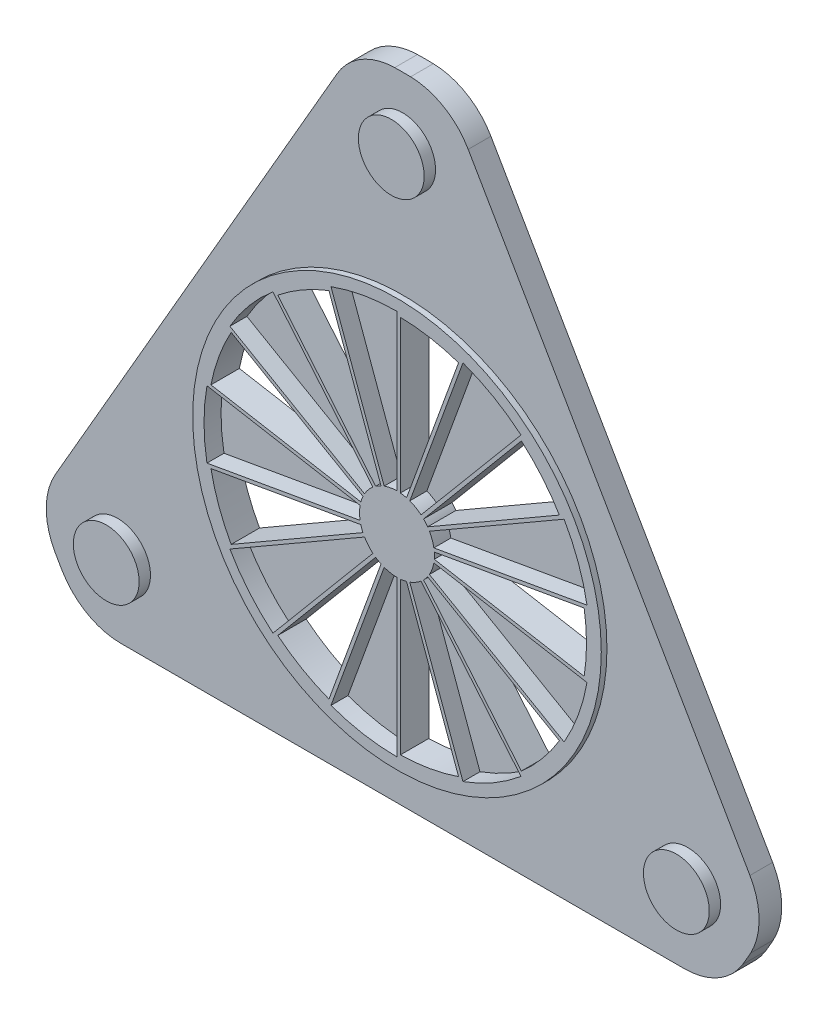
from build123d import *
from build123d.topology import SkipClean

# Parameters (mm, degrees)
SKETCH2_R           = 18
BOSS_EXTRUDE1_DEPTH = 2.5
BOSS_EXTRUDE7_START = -1
BOSS_EXTRUDE7_DEPTH = 1
BOSS_EXTRUDE9_START = -2.5
SKETCH17_R          = 3.3
BOSS_EXTRUDE9_DEPTH = 2.5
SKETCH9_R           = 3.098061326
BOSS_EXTRUDE5_DEPTH = 2.5
BOSS_EXTRUDE2_START = -2
SKETCH3_R           = 35
SKETCH3_R_2         = 18
BOSS_EXTRUDE2_DEPTH = 2
SKETCH4_R           = 2.9
BOSS_EXTRUDE3_DEPTH = 3
SKETCH6_R           = 5
BOSS_EXTRUDE4_DEPTH = 1
SKETCH7_R           = 59.131365533
CUT_EXTRUDE1_DEPTH  = 10
FILLET1_R           = 6


with BuildPart() as part:
    # Sketch2 → Boss-Extrude1 (new body)
    # profile 1 of 37: a face of its own
    with BuildSketch(Plane.XY.offset(10)):
        Circle(SKETCH2_R)
        with BuildLine():
            ThreePointArc((-5.814342437, 15.974774553), (-2.95201902, 16.741731801), (0, 17))
            ThreePointArc((0, 17), (2.95201902, 16.741731801), (5.814342437, 15.974774553))
            ThreePointArc((5.814342437, 15.974774553), (8.5, 14.722431864), (10.927389365, 13.022755533))
            ThreePointArc((10.927389365, 13.022755533), (13.022755533, 10.927389365), (14.722431864, 8.5))
            ThreePointArc((14.722431864, 8.5), (15.974774553, 5.814342437), (16.741731801, 2.95201902))
            ThreePointArc((16.741731801, 2.95201902), (16.935309868, 1.481647627), (17, 0))
            ThreePointArc((17, 0), (16.935309868, -1.481647627), (16.741731801, -2.95201902))
            ThreePointArc((16.741731801, -2.95201902), (15.974774553, -5.814342437), (14.722431864, -8.5))
            ThreePointArc((14.722431864, -8.5), (13.022755533, -10.927389365), (10.927389365, -13.022755533))
            ThreePointArc((10.927389365, -13.022755533), (8.5, -14.722431864), (5.814342437, -15.974774553))
            ThreePointArc((5.814342437, -15.974774553), (2.95201902, -16.741731801), (0, -17))
            ThreePointArc((0, -17), (-2.95201902, -16.741731801), (-5.814342437, -15.974774553))
            ThreePointArc((-5.814342437, -15.974774553), (-8.5, -14.722431864), (-10.927389365, -13.022755533))
            ThreePointArc((-10.927389365, -13.022755533), (-13.022755533, -10.927389365), (-14.722431864, -8.5))
            ThreePointArc((-14.722431864, -8.5), (-15.974774553, -5.814342437), (-16.741731801, -2.95201902))
            ThreePointArc((-16.741731801, -2.95201902), (-17, 0), (-16.741731801, 2.95201902))
            ThreePointArc((-16.741731801, 2.95201902), (-15.974774553, 5.814342437), (-14.722431864, 8.5))
            ThreePointArc((-14.722431864, 8.5), (-13.022755533, 10.927389365), (-10.927389365, 13.022755533))
            ThreePointArc((-10.927389365, 13.022755533), (-8.5, 14.722431864), (-5.814342437, 15.974774553))
        make_face(mode=Mode.SUBTRACT)
    # profile 2 of 37: a face of its own
    with BuildSketch(Plane.XY.offset(10)):
        with BuildLine():
            Line((0, 17), (0, 16.697537549))
            ThreePointArc((0, 16.697537549), (0.150006053, 16.696863729), (0.3, 16.694842323))
            ThreePointArc((0.3, 16.694842323), (2.899496967, 16.443864434), (5.428064578, 15.790626179))
            ThreePointArc((5.428064578, 15.790626179), (5.569704144, 15.741224728), (5.710894186, 15.69055282))
            Line((5.710894186, 15.69055282), (5.814342437, 15.974774553))
            ThreePointArc((5.814342437, 15.974774553), (2.95201902, 16.741731801), (0, 17))
        make_face()
    # profile 3 of 37: a face of its own
    with BuildSketch(Plane.XY.offset(10)):
        with BuildLine():
            ThreePointArc((-5.99188015, 15.585414093), (-5.851623307, 15.638614544), (-5.710894186, 15.69055282))
            Line((-5.710894186, 15.69055282), (-5.814342437, 15.974774553))
            ThreePointArc((-5.814342437, 15.974774553), (-8.5, 14.722431864), (-10.927389365, 13.022755533))
            Line((-10.927389365, 13.022755533), (-10.732970249, 12.791055853))
            ThreePointArc((-10.732970249, 12.791055853), (-10.617625822, 12.886961709), (-10.501424458, 12.981827473))
            ThreePointArc((-10.501424458, 12.981827473), (-8.348768774, 14.460491698), (-5.99188015, 15.585414093))
        make_face()
    # profile 4 of 37: a face of its own
    with BuildSketch(Plane.XY.offset(10)):
        with BuildLine():
            ThreePointArc((-14.608157564, 8.08761354), (-14.534911179, 8.218522811), (-14.460491698, 8.348768774))
            Line((-14.460491698, 8.348768774), (-14.722431864, 8.5))
            ThreePointArc((-14.722431864, 8.5), (-15.974774553, 5.814342437), (-16.741731801, 2.95201902))
            Line((-16.741731801, 2.95201902), (-16.443864434, 2.899496967))
            ThreePointArc((-16.443864434, 2.899496967), (-16.417152573, 3.047107084), (-16.389115702, 3.194471272))
            ThreePointArc((-16.389115702, 3.194471272), (-15.69055282, 5.710894186), (-14.608157564, 8.08761354))
        make_face()
    # profile 5 of 37: a face of its own
    with BuildSketch(Plane.XY.offset(10)):
        with BuildLine():
            ThreePointArc((-16.389115702, -3.194471272), (-16.417152573, -3.047107084), (-16.443864434, -2.899496967))
            Line((-16.443864434, -2.899496967), (-16.741731801, -2.95201902))
            ThreePointArc((-16.741731801, -2.95201902), (-15.974774553, -5.814342437), (-14.722431864, -8.5))
            Line((-14.722431864, -8.5), (-14.460491698, -8.348768774))
            ThreePointArc((-14.460491698, -8.348768774), (-14.534911179, -8.218522811), (-14.608157564, -8.08761354))
            ThreePointArc((-14.608157564, -8.08761354), (-15.69055282, -5.710894186), (-16.389115702, -3.194471272))
        make_face()
    # profile 6 of 37: a face of its own
    with BuildSketch(Plane.XY.offset(10)):
        with BuildLine():
            ThreePointArc((-10.501424458, -12.981827473), (-10.617625822, -12.886961709), (-10.732970249, -12.791055853))
            Line((-10.732970249, -12.791055853), (-10.927389365, -13.022755533))
            ThreePointArc((-10.927389365, -13.022755533), (-8.5, -14.722431864), (-5.814342437, -15.974774553))
            Line((-5.814342437, -15.974774553), (-5.710894186, -15.69055282))
            ThreePointArc((-5.710894186, -15.69055282), (-5.851623307, -15.638614544), (-5.99188015, -15.585414093))
            ThreePointArc((-5.99188015, -15.585414093), (-8.348768774, -14.460491698), (-10.501424458, -12.981827473))
        make_face()
    # profile 7 of 37: a face of its own
    with BuildSketch(Plane.XY.offset(10)):
        with BuildLine():
            Line((5.814342437, -15.974774553), (5.710894186, -15.69055282))
            ThreePointArc((5.710894186, -15.69055282), (5.569704144, -15.741224728), (5.428064578, -15.790626179))
            ThreePointArc((5.428064578, -15.790626179), (2.899496967, -16.443864434), (0.3, -16.694842323))
            ThreePointArc((0.3, -16.694842323), (0.150006053, -16.696863729), (0, -16.697537549))
            Line((0, -16.697537549), (0, -17))
            ThreePointArc((0, -17), (2.95201902, -16.741731801), (5.814342437, -15.974774553))
        make_face()
    # profile 8 of 37: a face of its own
    with BuildSketch(Plane.XY.offset(10)):
        with BuildLine():
            Line((14.722431864, -8.5), (14.460491698, -8.348768774))
            ThreePointArc((14.460491698, -8.348768774), (14.384905126, -8.478340917), (14.308157564, -8.607228783))
            ThreePointArc((14.308157564, -8.607228783), (12.791055853, -10.732970249), (10.961051124, -12.596154907))
            ThreePointArc((10.961051124, -12.596154907), (10.847448429, -12.694117644), (10.732970249, -12.791055853))
            Line((10.732970249, -12.791055853), (10.927389365, -13.022755533))
            ThreePointArc((10.927389365, -13.022755533), (13.022755533, -10.927389365), (14.722431864, -8.5))
        make_face()
    # profile 9 of 37: a face of its own
    with BuildSketch(Plane.XY.offset(10)):
        with BuildLine():
            ThreePointArc((0.842085099, 3.190751116), (0.986397435, 3.149130054), (1.128666473, 3.100985649))
            Line((1.128666473, 3.100985649), (5.710894186, 15.69055282))
            ThreePointArc((5.710894186, 15.69055282), (5.569704144, 15.741224728), (5.428064578, 15.790626179))
            Line((5.428064578, 15.790626179), (0.842085099, 3.190751116))
        make_face()
    # profile 10 of 37: a face of its own
    with BuildSketch(Plane.XY.offset(10)):
        with BuildLine():
            Line((0, 16.697537549), (0, 3.3))
            ThreePointArc((0, 3.3), (0.150155522, 3.296582066), (0.3, 3.286335345))
            Line((0.3, 3.286335345), (0.3, 16.694842323))
            ThreePointArc((0.3, 16.694842323), (0.150006053, 16.696863729), (0, 16.697537549))
        make_face()
    # profile 11 of 37: a face of its own
    with BuildSketch(Plane.XY.offset(10)):
        with BuildLine():
            ThreePointArc((-1.405900672, 2.98553903), (-1.268597506, 3.046417628), (-1.128666473, 3.100985649))
            Line((-1.128666473, 3.100985649), (-5.710894186, 15.69055282))
            ThreePointArc((-5.710894186, 15.69055282), (-5.851623307, 15.638614544), (-5.99188015, 15.585414093))
            Line((-5.99188015, 15.585414093), (-1.405900672, 2.98553903))
        make_face()
    # profile 12 of 37: a face of its own
    with BuildSketch(Plane.XY.offset(10)):
        with BuildLine():
            Line((-10.732970249, 12.791055853), (-2.121199112, 2.527946662))
            ThreePointArc((-2.121199112, 2.527946662), (-2.003976303, 2.621846482), (-1.882602308, 2.710315212))
            Line((-1.882602308, 2.710315212), (-10.501424458, 12.981827473))
            ThreePointArc((-10.501424458, 12.981827473), (-10.617625822, 12.886961709), (-10.732970249, 12.791055853))
        make_face()
    # profile 13 of 37: a face of its own
    with BuildSketch(Plane.XY.offset(10)):
        with BuildLine():
            ThreePointArc((-2.996049894, 1.383360051), (-2.930001576, 1.518252537), (-2.857883832, 1.65))
            Line((-2.857883832, 1.65), (-14.460491698, 8.348768774))
            ThreePointArc((-14.460491698, 8.348768774), (-14.534911179, 8.218522811), (-14.608157564, 8.08761354))
            Line((-14.608157564, 8.08761354), (-2.996049894, 1.383360051))
        make_face()
    # profile 14 of 37: a face of its own
    with BuildSketch(Plane.XY.offset(10)):
        with BuildLine():
            Line((-16.443864434, 2.899496967), (-3.249865585, 0.573038986))
            ThreePointArc((-3.249865585, 0.573038986), (-3.220425345, 0.72031979), (-3.184314073, 0.86610847))
            Line((-3.184314073, 0.86610847), (-16.389115702, 3.194471272))
            ThreePointArc((-16.389115702, 3.194471272), (-16.417152573, 3.047107084), (-16.443864434, 2.899496967))
        make_face()
    # profile 15 of 37: a face of its own
    with BuildSketch(Plane.XY.offset(10)):
        with BuildLine():
            ThreePointArc((-3.184314073, -0.86610847), (-3.220425345, -0.72031979), (-3.249865585, -0.573038986))
            Line((-3.249865585, -0.573038986), (-16.443864434, -2.899496967))
            ThreePointArc((-16.443864434, -2.899496967), (-16.417152573, -3.047107084), (-16.389115702, -3.194471272))
            Line((-16.389115702, -3.194471272), (-3.184314073, -0.86610847))
        make_face()
    # profile 16 of 37: a face of its own
    with BuildSketch(Plane.XY.offset(10)):
        with BuildLine():
            Line((-14.460491698, -8.348768774), (-2.857883832, -1.65))
            ThreePointArc((-2.857883832, -1.65), (-2.930001576, -1.518252537), (-2.996049894, -1.383360051))
            Line((-2.996049894, -1.383360051), (-14.608157564, -8.08761354))
            ThreePointArc((-14.608157564, -8.08761354), (-14.534911179, -8.218522811), (-14.460491698, -8.348768774))
        make_face()
    # profile 17 of 37: a face of its own
    with BuildSketch(Plane.XY.offset(10)):
        with BuildLine():
            ThreePointArc((-1.882602308, -2.710315212), (-2.003976303, -2.621846482), (-2.121199112, -2.527946662))
            Line((-2.121199112, -2.527946662), (-10.732970249, -12.791055853))
            ThreePointArc((-10.732970249, -12.791055853), (-10.617625822, -12.886961709), (-10.501424458, -12.981827473))
            Line((-10.501424458, -12.981827473), (-1.882602308, -2.710315212))
        make_face()
    # profile 18 of 37: a face of its own
    with BuildSketch(Plane.XY.offset(10)):
        with BuildLine():
            Line((-5.710894186, -15.69055282), (-1.128666473, -3.100985649))
            ThreePointArc((-1.128666473, -3.100985649), (-1.268597506, -3.046417628), (-1.405900672, -2.98553903))
            Line((-1.405900672, -2.98553903), (-5.99188015, -15.585414093))
            ThreePointArc((-5.99188015, -15.585414093), (-5.851623307, -15.638614544), (-5.710894186, -15.69055282))
        make_face()
    # profile 19 of 37: a face of its own
    with BuildSketch(Plane.XY.offset(10)):
        with BuildLine():
            ThreePointArc((0.3, -3.286335345), (0.150155522, -3.296582066), (0, -3.3))
            Line((0, -3.3), (0, -16.697537549))
            ThreePointArc((0, -16.697537549), (0.150006053, -16.696863729), (0.3, -16.694842323))
            Line((0.3, -16.694842323), (0.3, -3.286335345))
        make_face()
    # profile 20 of 37: a face of its own
    with BuildSketch(Plane.XY.offset(10)):
        with BuildLine():
            Line((5.710894186, -15.69055282), (1.128666473, -3.100985649))
            ThreePointArc((1.128666473, -3.100985649), (0.986397435, -3.149130054), (0.842085099, -3.190751116))
            Line((0.842085099, -3.190751116), (5.428064578, -15.790626179))
            ThreePointArc((5.428064578, -15.790626179), (5.569704144, -15.741224728), (5.710894186, -15.69055282))
        make_face()
    # profile 21 of 37: a face of its own
    with BuildSketch(Plane.XY.offset(10)):
        with BuildLine():
            ThreePointArc((2.342228974, -2.324642646), (2.234027909, -2.428810264), (2.121199112, -2.527946662))
            Line((2.121199112, -2.527946662), (10.732970249, -12.791055853))
            ThreePointArc((10.732970249, -12.791055853), (10.847448429, -12.694117644), (10.961051124, -12.596154907))
            Line((10.961051124, -12.596154907), (2.342228974, -2.324642646))
        make_face()
    # profile 22 of 37: a face of its own
    with BuildSketch(Plane.XY.offset(10)):
        with BuildLine():
            Line((14.460491698, -8.348768774), (2.857883832, -1.65))
            ThreePointArc((2.857883832, -1.65), (2.779846054, -1.778329529), (2.696049894, -1.902975294))
            Line((2.696049894, -1.902975294), (14.308157564, -8.607228783))
            ThreePointArc((14.308157564, -8.607228783), (14.384905126, -8.478340917), (14.460491698, -8.348768774))
        make_face()
    # profile 23 of 37: a face of its own
    with BuildSketch(Plane.XY.offset(10)):
        with BuildLine():
            Line((0, 3.3), (0, 2.988310559))
            ThreePointArc((0, 2.988310559), (0.518914683, 2.942911407), (1.022062406, 2.808093381))
            Line((1.022062406, 2.808093381), (1.128666473, 3.100985649))
            ThreePointArc((1.128666473, 3.100985649), (0.986397435, 3.149130054), (0.842085099, 3.190751116))
            ThreePointArc((0.842085099, 3.190751116), (0.573038986, 3.249865585), (0.3, 3.286335345))
            ThreePointArc((0.3, 3.286335345), (0.150155522, 3.296582066), (0, 3.3))
        make_face()
    # profile 24 of 37: a face of its own
    with BuildSketch(Plane.XY.offset(10)):
        with BuildLine():
            ThreePointArc((-1.920849002, 2.289178698), (-1.49415528, 2.587952859), (-1.022062406, 2.808093381))
            Line((-1.022062406, 2.808093381), (-1.128666473, 3.100985649))
            ThreePointArc((-1.128666473, 3.100985649), (-1.268597506, 3.046417628), (-1.405900672, 2.98553903))
            ThreePointArc((-1.405900672, 2.98553903), (-1.65, 2.857883832), (-1.882602308, 2.710315212))
            ThreePointArc((-1.882602308, 2.710315212), (-2.003976303, 2.621846482), (-2.121199112, 2.527946662))
            Line((-2.121199112, 2.527946662), (-1.920849002, 2.289178698))
        make_face()
    # profile 25 of 37: a face of its own
    with BuildSketch(Plane.XY.offset(10)):
        with BuildLine():
            ThreePointArc((-2.942911407, 0.518914683), (-2.808093381, 1.022062406), (-2.587952859, 1.49415528))
            Line((-2.587952859, 1.49415528), (-2.857883832, 1.65))
            ThreePointArc((-2.857883832, 1.65), (-2.930001576, 1.518252537), (-2.996049894, 1.383360051))
            ThreePointArc((-2.996049894, 1.383360051), (-3.100985649, 1.128666473), (-3.184314073, 0.86610847))
            ThreePointArc((-3.184314073, 0.86610847), (-3.220425345, 0.72031979), (-3.249865585, 0.573038986))
            Line((-3.249865585, 0.573038986), (-2.942911407, 0.518914683))
        make_face()
    # profile 26 of 37: a face of its own
    with BuildSketch(Plane.XY.offset(10)):
        with BuildLine():
            ThreePointArc((-2.587952859, -1.49415528), (-2.808093381, -1.022062406), (-2.942911407, -0.518914683))
            Line((-2.942911407, -0.518914683), (-3.249865585, -0.573038986))
            ThreePointArc((-3.249865585, -0.573038986), (-3.220425345, -0.72031979), (-3.184314073, -0.86610847))
            ThreePointArc((-3.184314073, -0.86610847), (-3.100985649, -1.128666473), (-2.996049894, -1.383360051))
            ThreePointArc((-2.996049894, -1.383360051), (-2.930001576, -1.518252537), (-2.857883832, -1.65))
            Line((-2.857883832, -1.65), (-2.587952859, -1.49415528))
        make_face()
    # profile 27 of 37: a face of its own
    with BuildSketch(Plane.XY.offset(10)):
        with BuildLine():
            ThreePointArc((-1.022062406, -2.808093381), (-1.49415528, -2.587952859), (-1.920849002, -2.289178698))
            Line((-1.920849002, -2.289178698), (-2.121199112, -2.527946662))
            ThreePointArc((-2.121199112, -2.527946662), (-2.003976303, -2.621846482), (-1.882602308, -2.710315212))
            ThreePointArc((-1.882602308, -2.710315212), (-1.65, -2.857883832), (-1.405900672, -2.98553903))
            ThreePointArc((-1.405900672, -2.98553903), (-1.268597506, -3.046417628), (-1.128666473, -3.100985649))
            Line((-1.128666473, -3.100985649), (-1.022062406, -2.808093381))
        make_face()
    # profile 28 of 37: a face of its own
    with BuildSketch(Plane.XY.offset(10)):
        with BuildLine():
            Line((1.128666473, -3.100985649), (1.022062406, -2.808093381))
            ThreePointArc((1.022062406, -2.808093381), (0.518914683, -2.942911407), (0, -2.988310559))
            Line((0, -2.988310559), (0, -3.3))
            ThreePointArc((0, -3.3), (0.150155522, -3.296582066), (0.3, -3.286335345))
            ThreePointArc((0.3, -3.286335345), (0.573038986, -3.249865585), (0.842085099, -3.190751116))
            ThreePointArc((0.842085099, -3.190751116), (0.986397435, -3.149130054), (1.128666473, -3.100985649))
        make_face()
    # profile 29 of 37: a face of its own
    with BuildSketch(Plane.XY.offset(10)):
        with BuildLine():
            Line((2.857883832, -1.65), (2.587952859, -1.49415528))
            ThreePointArc((2.587952859, -1.49415528), (2.289178698, -1.920849002), (1.920849002, -2.289178698))
            Line((1.920849002, -2.289178698), (2.121199112, -2.527946662))
            ThreePointArc((2.121199112, -2.527946662), (2.234027909, -2.428810264), (2.342228974, -2.324642646))
            ThreePointArc((2.342228974, -2.324642646), (2.527946662, -2.121199112), (2.696049894, -1.902975294))
            ThreePointArc((2.696049894, -1.902975294), (2.779846054, -1.778329529), (2.857883832, -1.65))
        make_face()
    # profile 30 of 37: a face of its own
    with BuildSketch(Plane.XY.offset(10)):
        with BuildLine():
            Line((3.249865585, 0.573038986), (2.942911407, 0.518914683))
            ThreePointArc((2.942911407, 0.518914683), (2.976939136, 0.260448426), (2.988310559, 0))
            ThreePointArc((2.988310559, 0), (2.976939136, -0.260448426), (2.942911407, -0.518914683))
            Line((2.942911407, -0.518914683), (3.249865585, -0.573038986))
            ThreePointArc((3.249865585, -0.573038986), (3.27257381, -0.424571146), (3.28850298, -0.275223818))
            ThreePointArc((3.28850298, -0.275223818), (3.297124492, -0.137731924), (3.3, 0))
            ThreePointArc((3.3, 0), (3.297124492, 0.137731924), (3.28850298, 0.275223818))
            ThreePointArc((3.28850298, 0.275223818), (3.27257381, 0.424571146), (3.249865585, 0.573038986))
        make_face()
    # profile 31 of 37: a face of its own
    with BuildSketch(Plane.XY.offset(10)):
        with BuildLine():
            ThreePointArc((3.28850298, -0.275223818), (3.27257381, -0.424571146), (3.249865585, -0.573038986))
            Line((3.249865585, -0.573038986), (16.443864434, -2.899496967))
            ThreePointArc((16.443864434, -2.899496967), (16.469249129, -2.751652835), (16.493304608, -2.60358662))
            Line((16.493304608, -2.60358662), (3.28850298, -0.275223818))
        make_face()
    # profile 32 of 37: a face of its own
    with BuildSketch(Plane.XY.offset(10)):
        with BuildLine():
            Line((16.443864434, 2.899496967), (3.249865585, 0.573038986))
            ThreePointArc((3.249865585, 0.573038986), (3.27257381, 0.424571146), (3.28850298, 0.275223818))
            Line((3.28850298, 0.275223818), (16.493304608, 2.60358662))
            ThreePointArc((16.493304608, 2.60358662), (16.469249129, 2.751652835), (16.443864434, 2.899496967))
        make_face()
    # profile 33 of 37: a face of its own
    with BuildSketch(Plane.XY.offset(10)):
        with BuildLine():
            Line((16.741731801, 2.95201902), (16.443864434, 2.899496967))
            ThreePointArc((16.443864434, 2.899496967), (16.469249129, 2.751652835), (16.493304608, 2.60358662))
            ThreePointArc((16.493304608, 2.60358662), (16.64640101, 1.305792325), (16.697537549, 0))
            ThreePointArc((16.697537549, 0), (16.64640101, -1.305792325), (16.493304608, -2.60358662))
            ThreePointArc((16.493304608, -2.60358662), (16.469249129, -2.751652835), (16.443864434, -2.899496967))
            Line((16.443864434, -2.899496967), (16.741731801, -2.95201902))
            ThreePointArc((16.741731801, -2.95201902), (16.935309868, -1.481647627), (17, 0))
            ThreePointArc((17, 0), (16.935309868, 1.481647627), (16.741731801, 2.95201902))
        make_face()
    # profile 34 of 37: a face of its own
    with BuildSketch(Plane.XY.offset(10)):
        with BuildLine():
            Line((2.121199112, 2.527946662), (1.920849002, 2.289178698))
            ThreePointArc((1.920849002, 2.289178698), (2.289178698, 1.920849002), (2.587952859, 1.49415528))
            Line((2.587952859, 1.49415528), (2.857883832, 1.65))
            ThreePointArc((2.857883832, 1.65), (2.779846054, 1.778329529), (2.696049894, 1.902975294))
            ThreePointArc((2.696049894, 1.902975294), (2.527946662, 2.121199112), (2.342228974, 2.324642646))
            ThreePointArc((2.342228974, 2.324642646), (2.234027909, 2.428810264), (2.121199112, 2.527946662))
        make_face()
    # profile 35 of 37: a face of its own
    with BuildSketch(Plane.XY.offset(10)):
        with BuildLine():
            ThreePointArc((2.696049894, 1.902975294), (2.779846054, 1.778329529), (2.857883832, 1.65))
            Line((2.857883832, 1.65), (14.460491698, 8.348768774))
            ThreePointArc((14.460491698, 8.348768774), (14.384905126, 8.478340917), (14.308157564, 8.607228783))
            Line((14.308157564, 8.607228783), (2.696049894, 1.902975294))
        make_face()
    # profile 36 of 37: a face of its own
    with BuildSketch(Plane.XY.offset(10)):
        with BuildLine():
            Line((10.732970249, 12.791055853), (2.121199112, 2.527946662))
            ThreePointArc((2.121199112, 2.527946662), (2.234027909, 2.428810264), (2.342228974, 2.324642646))
            Line((2.342228974, 2.324642646), (10.961051124, 12.596154907))
            ThreePointArc((10.961051124, 12.596154907), (10.847448429, 12.694117644), (10.732970249, 12.791055853))
        make_face()
    # profile 37 of 37: a face of its own
    with BuildSketch(Plane.XY.offset(10)):
        with BuildLine():
            Line((10.927389365, 13.022755533), (10.732970249, 12.791055853))
            ThreePointArc((10.732970249, 12.791055853), (10.847448429, 12.694117644), (10.961051124, 12.596154907))
            ThreePointArc((10.961051124, 12.596154907), (12.791055853, 10.732970249), (14.308157564, 8.607228783))
            ThreePointArc((14.308157564, 8.607228783), (14.384905126, 8.478340917), (14.460491698, 8.348768774))
            Line((14.460491698, 8.348768774), (14.722431864, 8.5))
            ThreePointArc((14.722431864, 8.5), (13.022755533, 10.927389365), (10.927389365, 13.022755533))
        make_face()
    extrude(amount=-BOSS_EXTRUDE1_DEPTH)

    # Sketch11 → Boss-Extrude7 (add)
    with SkipClean():  # the faces are left unmerged after this step: merging them gives an invalid solid
        with BuildSketch(Plane(origin=(0, 0, 7.5), x_dir=(-1, 0, 0), z_dir=(0, 0, -1)).offset(BOSS_EXTRUDE7_START)):
            with BuildLine():
                Line((11.570176974, 13.788799976), (1.920849002, 2.289178698))
                ThreePointArc((1.920849002, 2.289178698), (2.289178698, 1.920849002), (2.587952859, 1.49415528))
                Line((2.587952859, 1.49415528), (15.588457268, 9))
                ThreePointArc((15.588457268, 9), (13.788799976, 11.570176974), (11.570176974, 13.788799976))
            make_face()
            with BuildLine():
                Line((17.726539554, 3.125667198), (2.942911407, 0.518914683))
                ThreePointArc((2.942911407, 0.518914683), (2.976939136, 0.260448426), (2.988310559, 0))
                ThreePointArc((2.988310559, 0), (2.976939136, -0.260448426), (2.942911407, -0.518914683))
                Line((2.942911407, -0.518914683), (17.726539554, -3.125667198))
                ThreePointArc((17.726539554, -3.125667198), (18, 0), (17.726539554, 3.125667198))
            make_face()
            with BuildLine():
                Line((15.588457268, -9), (2.587952859, -1.49415528))
                ThreePointArc((2.587952859, -1.49415528), (2.289178698, -1.920849002), (1.920849002, -2.289178698))
                Line((1.920849002, -2.289178698), (11.570176974, -13.788799976))
                ThreePointArc((11.570176974, -13.788799976), (13.788799976, -11.570176974), (15.588457268, -9))
            make_face()
            with BuildLine():
                Line((6.15636258, -16.914467174), (1.022062406, -2.808093381))
                ThreePointArc((1.022062406, -2.808093381), (0.518914683, -2.942911407), (0, -2.988310559))
                Line((0, -2.988310559), (0, -18))
                ThreePointArc((0, -18), (3.125667198, -17.726539554), (6.15636258, -16.914467174))
            make_face()
            with BuildLine():
                ThreePointArc((-1.022062406, -2.808093381), (-1.49415528, -2.587952859), (-1.920849002, -2.289178698))
                Line((-1.920849002, -2.289178698), (-11.570176974, -13.788799976))
                ThreePointArc((-11.570176974, -13.788799976), (-9, -15.588457268), (-6.15636258, -16.914467174))
                Line((-6.15636258, -16.914467174), (-1.022062406, -2.808093381))
            make_face()
            with BuildLine():
                ThreePointArc((-2.587952859, -1.49415528), (-2.808093381, -1.022062406), (-2.942911407, -0.518914683))
                Line((-2.942911407, -0.518914683), (-17.726539554, -3.125667198))
                ThreePointArc((-17.726539554, -3.125667198), (-16.914467174, -6.15636258), (-15.588457268, -9))
                Line((-15.588457268, -9), (-2.587952859, -1.49415528))
            make_face()
            with BuildLine():
                ThreePointArc((-2.942911407, 0.518914683), (-2.808093381, 1.022062406), (-2.587952859, 1.49415528))
                Line((-2.587952859, 1.49415528), (-15.588457268, 9))
                ThreePointArc((-15.588457268, 9), (-16.914467174, 6.15636258), (-17.726539554, 3.125667198))
                Line((-17.726539554, 3.125667198), (-2.942911407, 0.518914683))
            make_face()
            with BuildLine():
                ThreePointArc((-1.920849002, 2.289178698), (-1.49415528, 2.587952859), (-1.022062406, 2.808093381))
                Line((-1.022062406, 2.808093381), (-6.15636258, 16.914467174))
                ThreePointArc((-6.15636258, 16.914467174), (-9, 15.588457268), (-11.570176974, 13.788799976))
                Line((-11.570176974, 13.788799976), (-1.920849002, 2.289178698))
            make_face()
            with BuildLine():
                Line((0, 18), (0, 2.988310559))
                ThreePointArc((0, 2.988310559), (0.518914683, 2.942911407), (1.022062406, 2.808093381))
                Line((1.022062406, 2.808093381), (6.15636258, 16.914467174))
                ThreePointArc((6.15636258, 16.914467174), (3.125667198, 17.726539554), (0, 18))
            make_face()
        extrude(amount=BOSS_EXTRUDE7_DEPTH)

    # Sketch17 → Boss-Extrude9 (add)
    with SkipClean():  # the faces are left unmerged after this step: merging them gives an invalid solid
        with BuildSketch(Plane(origin=(0, 0, 7.5), x_dir=(-1, 0, 0), z_dir=(0, 0, -1)).offset(BOSS_EXTRUDE9_START)):
            Circle(SKETCH17_R)
        extrude(amount=BOSS_EXTRUDE9_DEPTH)

    # Sketch9 → Boss-Extrude5 (add)
    with SkipClean():  # the faces are left unmerged after this step: merging them gives an invalid solid
        with BuildSketch(Plane.XY.offset(10)):
            Circle(SKETCH9_R)
        extrude(amount=-BOSS_EXTRUDE5_DEPTH)

    # Sketch3 → Boss-Extrude2 (add)
    with BuildSketch(Plane(origin=(0, 0, 7.5), x_dir=(-1, 0, 0), z_dir=(0, 0, -1)).offset(BOSS_EXTRUDE2_START)):
        Circle(SKETCH3_R)
        with Locations(Location((0, 0, 0), (0, 0, 180))):
            Circle(SKETCH3_R_2, mode=Mode.SUBTRACT)
    extrude(amount=BOSS_EXTRUDE2_DEPTH)

    # Sketch4 → Boss-Extrude3 (add)
    with BuildSketch(Plane(origin=(0, 0, 7.5), x_dir=(-1, 0, 0), z_dir=(0, 0, -1))):
        with Locations((0, 29)):
            Circle(SKETCH4_R)
        with Locations((25.11473671, -14.5)):
            Circle(SKETCH4_R)
        with Locations((-25.11473671, -14.5)):
            Circle(SKETCH4_R)
    extrude(amount=-BOSS_EXTRUDE3_DEPTH)

    # Sketch6 → Boss-Extrude4 (add)
    with BuildSketch(Plane(origin=(0, 0, 9.5), x_dir=(-1, 0, 0), z_dir=(0, 0, -1))):
        with Locations((0, 30)):
            Circle(SKETCH6_R)
        with Locations((25.980762114, -15)):
            Circle(SKETCH6_R)
        with Locations((-25.980762114, -15)):
            Circle(SKETCH6_R)
    extrude(amount=BOSS_EXTRUDE4_DEPTH)

    # Sketch7 → Cut-Extrude1 (cut)
    with BuildSketch(Plane(origin=(0, 0, 7.5), x_dir=(-1, 0, 0), z_dir=(0, 0, -1))):
        Circle(SKETCH7_R)
        Polygon((0, 42), (-36.373066959, -21), (36.373066959, -21), align=None, mode=Mode.SUBTRACT)
    extrude(amount=-CUT_EXTRUDE1_DEPTH, mode=Mode.SUBTRACT)

    # Fillet1
    fillet1_edges = [part.edges().sort_by_distance(p)[0] for p in [
        (-4.186533479, 34.748711306, 8.5),
        (-32.186533479, -13.748711306, 8.5),
        (-28, -21, 8.5),
        (28, -21, 8.5),
        (32.186533479, -13.748711306, 8.5),
        (4.186533479, 34.748711306, 8.5),
    ]]
    fillet(fillet1_edges, radius=FILLET1_R)


solid = part.part
